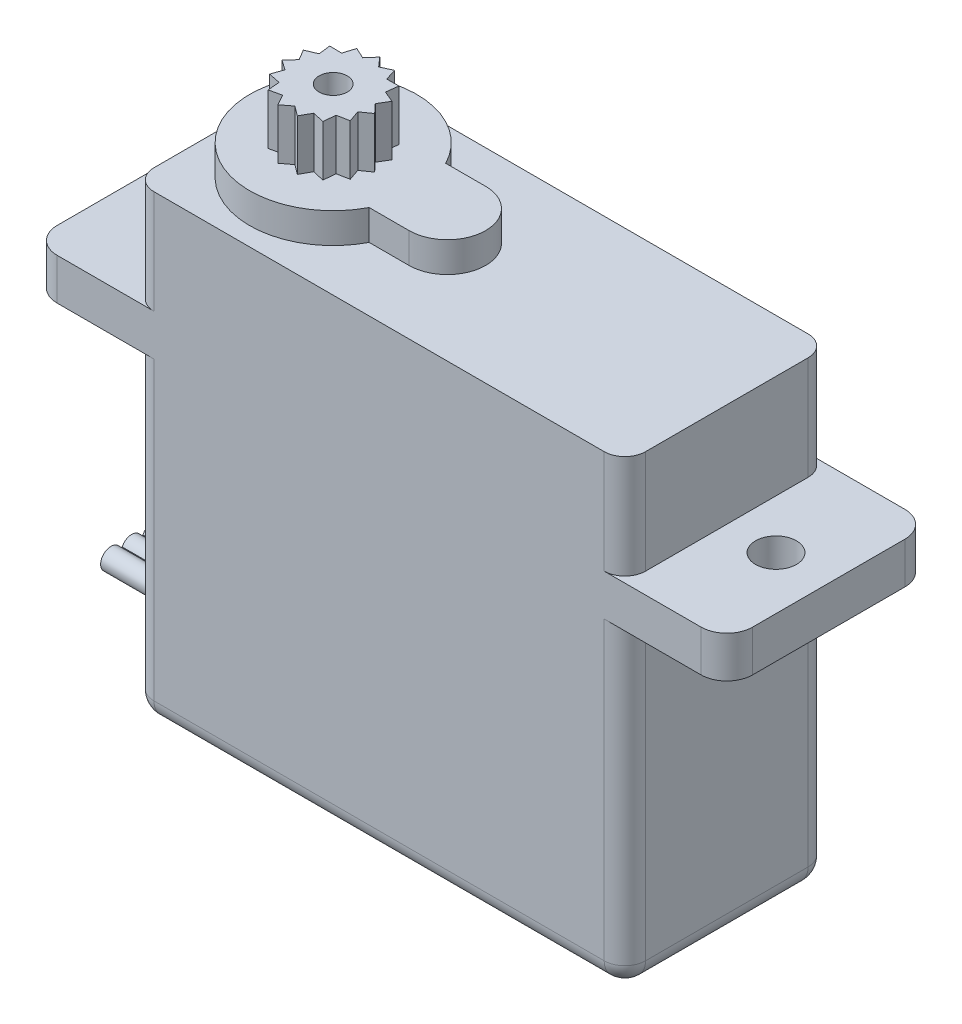
from build123d import *

# Parameters (mm, degrees)
BOSS_EXTRUDE1_DEPTH = 4.925
BOSS_EXTRUDE3_DEPTH = 1.46
SKETCH6_R           = 0.68
BOSS_EXTRUDE4_DEPTH = 2.45
SKETCH2_R           = 0.99
CUT_EXTRUDE6_DEPTH  = 10
FILLET1_R           = 1
FILLET2_R           = 1.25
BOSS_EXTRUDE5_DEPTH = 5


with BuildPart() as part:
    # Sketch1 → Boss-Extrude1 (new, symmetric)
    with BuildSketch(Plane.XY):
        Polygon((0, 0), (0, 15.3), (-4.925, 15.3), (-4.925, 17.3), (0, 17.3), (0, 22.3), (23.75, 22.3), (23.75, 17.3), (28.675, 17.3), (28.675, 15.3), (23.75, 15.3), (23.75, 0), align=None)
    extrude(amount=BOSS_EXTRUDE1_DEPTH, both=True)

    # Sketch5 → Boss-Extrude3 (add)
    with BuildSketch(Plane(origin=(0, 22.3, 0), x_dir=(1, 0, 0), z_dir=(0, 1, 0))):
        with BuildLine():
            Line((10.25, 1.85), (8.32090644, 1.85))
            ThreePointArc((8.32090644, 1.85), (0.7, 0), (8.32090644, -1.85))
            Line((8.32090644, -1.85), (10.25, -1.85))
            ThreePointArc((10.25, -1.85), (12.1, 0), (10.25, 1.85))
        make_face()
    extrude(amount=BOSS_EXTRUDE3_DEPTH)

    # Sketch6 → Boss-Extrude4 (add)
    with BuildSketch(Plane(origin=(0, 23.76, 0), x_dir=(1, 0, 0), z_dir=(0, 1, 0))):
        Polygon((4.350363372, 1.809573061), (4.735, 2.25), (5.119636628, 1.809573061), (5.650157447, 2.05547728), (5.822402717, 1.49668144), (6.407075857, 1.505543864), (6.337146997, 0.925), (6.874877162, 0.695288237), (6.574865506, 0.193377657), (6.972674265, -0.235189042), (6.494454555, -0.57168144), (6.683557159, -1.125), (6.109817927, -1.237891622), (6.057516818, -1.820288237), (5.48746279, -1.690059097), (5.202801304, -2.200832102), (4.735, -1.85), (4.267198696, -2.200832102), (3.98253721, -1.690059097), (3.412483182, -1.820288237), (3.360182073, -1.237891622), (2.786442841, -1.125), (2.975545445, -0.57168144), (2.497325735, -0.235189042), (2.895134494, 0.193377657), (2.595122838, 0.695288237), (3.132853003, 0.925), (3.062924143, 1.505543864), (3.647597283, 1.49668144), (3.819842553, 2.05547728), align=None)
        with Locations(Location((4.735, 0, 0), (0, 0, 270))):
            Circle(SKETCH6_R, mode=Mode.SUBTRACT)
    extrude(amount=BOSS_EXTRUDE4_DEPTH)

    # Sketch2 → Cut-Extrude6 (cut)
    with BuildSketch(Plane(origin=(0, 17.3, 0), x_dir=(1, 0, 0), z_dir=(0, 1, 0))):
        with Locations(Location((26.125, 0, 0), (0, 0, 270))):
            Circle(SKETCH2_R)
        with Locations(Location((-2.375, 0, 0), (0, 0, 270))):
            Circle(SKETCH2_R)
    extrude(amount=-CUT_EXTRUDE6_DEPTH, mode=Mode.SUBTRACT)

    # Fillet1
    fillet1_edges = [part.edges().sort_by_distance(p)[0] for p in [
        (0, 7.65, -4.925),
        (0, 19.8, -4.925),
        (23.75, 19.8, -4.925),
        (23.75, 7.65, -4.925),
        (11.875, 0, -4.925),
        (23.75, 19.8, 4.925),
        (0, 0, 0),
        (23.75, 0, 0),
        (0, 19.8, 4.925),
        (0, 7.65, 4.925),
        (11.875, 0, 4.925),
        (23.75, 7.65, 4.925),
    ]]
    fillet(fillet1_edges, radius=FILLET1_R)

    # Fillet2
    fillet2_edges = [part.edges().sort_by_distance(p)[0] for p in [
        (-4.925, 16.3, -4.925),
        (28.675, 16.3, 4.925),
        (28.675, 16.3, -4.925),
        (-4.925, 16.3, 4.925),
    ]]
    fillet(fillet2_edges, radius=FILLET2_R)

    # Sketch7 → Boss-Extrude5 (add)
    with BuildSketch(Plane.ZY):
        with BuildLine():
            Line((-0.543660539, 2.20433868), (-0.456339461, 2.20433868))
            ThreePointArc((-0.456339461, 2.20433868), (0, 2.5), (0.456339461, 2.20433868))
            Line((0.456339461, 2.20433868), (0.543660539, 2.20433868))
            ThreePointArc((0.543660539, 2.20433868), (1.5, 2), (0.543660539, 1.79566132))
            Line((0.543660539, 1.79566132), (0.456339461, 1.79566132))
            ThreePointArc((0.456339461, 1.79566132), (0, 1.5), (-0.456339461, 1.79566132))
            Line((-0.456339461, 1.79566132), (-0.543660539, 1.79566132))
            ThreePointArc((-0.543660539, 1.79566132), (-1.5, 2), (-0.543660539, 2.20433868))
        make_face()
    extrude(amount=BOSS_EXTRUDE5_DEPTH)


solid = part.part
